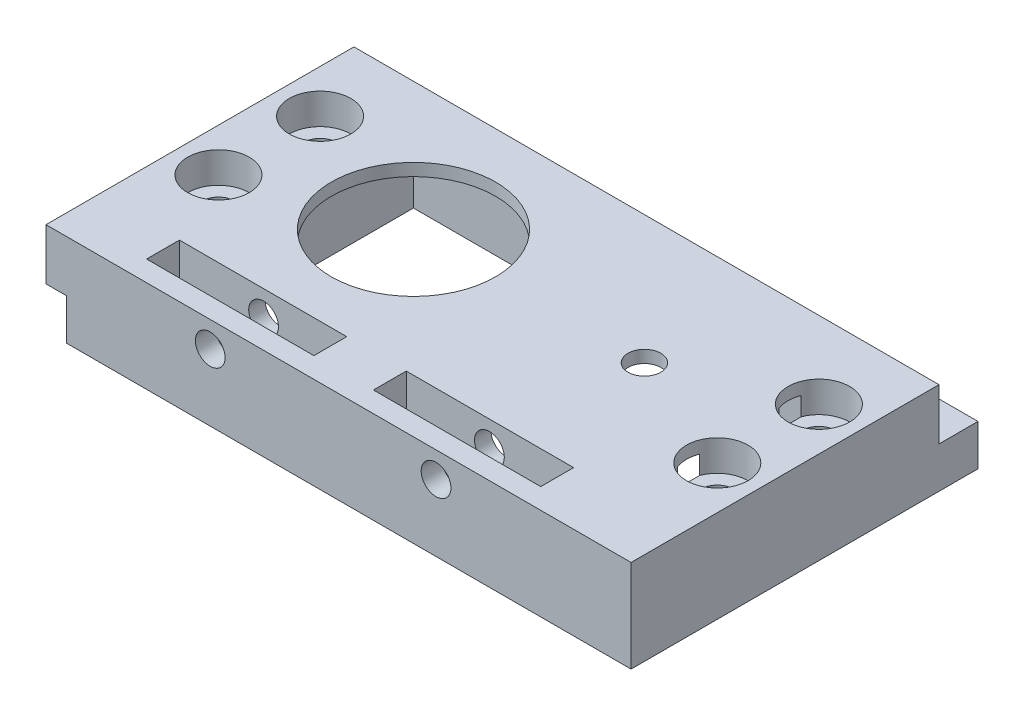
from build123d import *
from build123d.topology import SkipClean

# Parameters (mm, degrees)
SKETCH1_W                = 50
SKETCH1_H                = 25
SKETCH1_R                = 1.3
SKETCH1_R_2              = 4.5
BOSS_EXTRUDE1_DEPTH      = 2.5
SKETCH2_W                = 50
SKETCH2_H                = 12
BOSS_EXTRUDE2_DEPTH      = 3
SKETCH3_W                = 50
SKETCH3_H                = 28
BOSS_EXTRUDE3_DEPTH      = 3
SKETCH4_R                = 1.3
CUT_EXTRUDE1_DEPTH       = 34.018933962
SKETCH5_W                = 53
SKETCH5_H                = 32.5
SKETCH5_R                = 1.6
SKETCH5_W_2              = 42
SKETCH5_H_2              = 21.5
BOSS_EXTRUDE4_DEPTH      = 4
SKETCH7_R                = 8
CUT_EXTRUDE2_DEPTH       = 5
SKETCH8_W                = 24.55
SKETCH8_H                = 21.5
CUT_EXTRUDE3_DEPTH       = 3.8
BOSS_EXTRUDE6_DEPTH      = 22.95
BOSS_EXTRUDE7_DEPTH      = 2
CUT_EXTRUDE4_START       = -1.2
SKETCH11_R               = 1.6
CUT_EXTRUDE4_DEPTH       = 1.2
SKETCH12_W               = 7
SKETCH12_H               = 21
SKETCH12_R               = 1.6
BOSS_EXTRUDE8_DEPTH      = 7.8
CUT_EXTRUDE5_DEPTH       = 55.054972019
CUT_EXTRUDE5_DEPTH_BACK  = 55.054972019
SKETCH13_W               = 0.7
SKETCH13_H               = 5
SKETCH13_H_2             = 4
CUT_EXTRUDE6_DEPTH       = 78.713850117
CUT_EXTRUDE6_DEPTH_BACK  = 78.713850117
SKETCH14_W               = 28
SKETCH14_H               = 10
SKETCH16_R               = 3
CUT_EXTRUDE8_DEPTH       = 3
SKETCH15_R               = 1.6
CUT_EXTRUDE9_DEPTH       = 5
SKETCH17_W               = 16.3
SKETCH17_H               = 5
CUT_EXTRUDE10_DEPTH      = 3.2
SKETCH18_R               = 1.45
CUT_EXTRUDE11_DEPTH      = 5
CUT_EXTRUDE12_DEPTH      = 54.307527611
CUT_EXTRUDE12_DEPTH_BACK = 54.307527611
SKETCH19_R               = 1.6
CUT_EXTRUDE14_DEPTH      = 60.569224437
CUT_EXTRUDE14_DEPTH_BACK = 60.569224437
SKETCH20_W               = 17.95
SKETCH20_H               = 5
BOSS_EXTRUDE11_START     = 2
SKETCH21_W               = 16.3
SKETCH21_H               = 5
SKETCH21_R               = 1.45
BOSS_EXTRUDE11_DEPTH     = 2


with BuildPart() as part:
    # Sketch1 → Boss-Extrude1 (new, symmetric)
    with BuildSketch(Plane(origin=(0, 0, 0), x_dir=(1, 0, 0), z_dir=(0, 1, 0))):
        Rectangle(SKETCH1_W, SKETCH1_H)
        with Locations(Location((-11.25, 0, 0), (0, 0, 270))):
            Circle(SKETCH1_R, mode=Mode.SUBTRACT)
        with Locations(Location((11.25, 0, 0), (0, 0, 270))):
            Circle(SKETCH1_R_2, mode=Mode.SUBTRACT)
    extrude(amount=BOSS_EXTRUDE1_DEPTH, both=True)

    # Sketch2 → Boss-Extrude2 (add)
    with BuildSketch(Plane.XY.offset(12.5)):
        with Locations((0, 3.5)):
            Rectangle(SKETCH2_W, SKETCH2_H)
    extrude(amount=BOSS_EXTRUDE2_DEPTH)

    # Sketch3 → Boss-Extrude3 (add)
    with BuildSketch(Plane(origin=(0, 9.5, 0), x_dir=(1, 0, 0), z_dir=(0, 1, 0))):
        with Locations((0, -1.5)):
            Rectangle(SKETCH3_W, SKETCH3_H)
    extrude(amount=BOSS_EXTRUDE3_DEPTH)

    # Sketch4 → Cut-Extrude1 (cut, through all)
    with BuildSketch(Plane(origin=(0, 12.5, 0), x_dir=(1, 0, 0), z_dir=(0, 1, 0))):
        with Locations(Location((11.25, 0, 0), (0, 0, 270))):
            Circle(SKETCH4_R)
        with Locations(Location((-11.25, 0, 0), (0, 0, 270))):
            Circle(SKETCH4_R)
    extrude(amount=-CUT_EXTRUDE1_DEPTH, mode=Mode.SUBTRACT)

    # Sketch5 → Boss-Extrude4 (add)
    with BuildSketch(Plane.XZ.offset(2.5)):
        with Locations((21.45, -0.05)):
            Rectangle(SKETCH5_W, SKETCH5_H)
        with Locations(Location((45.75, -5, 0), (0, 0, 270))):
            Circle(SKETCH5_R, mode=Mode.SUBTRACT)
        with Locations(Location((45.75, 4.9, 0), (0, 0, 270))):
            Circle(SKETCH5_R, mode=Mode.SUBTRACT)
        with Locations(Location((-2.85, 4.9, 0), (0, 0, 270))):
            Circle(SKETCH5_R, mode=Mode.SUBTRACT)
        with Locations(Location((-2.85, -5, 0), (0, 0, 270))):
            Circle(SKETCH5_R, mode=Mode.SUBTRACT)
        with Locations((21.45, -0.05)):
            Rectangle(SKETCH5_W_2, SKETCH5_H_2, mode=Mode.SUBTRACT)
    extrude(amount=BOSS_EXTRUDE4_DEPTH)

    # Sketch7 → Cut-Extrude2 (cut)
    with BuildSketch(Plane.XZ.offset(2.5)):
        with Locations(Location((11.25, 0, 0), (0, 0, 270))):
            Circle(SKETCH7_R)
    extrude(amount=-CUT_EXTRUDE2_DEPTH, mode=Mode.SUBTRACT)

    # Sketch8 → Cut-Extrude3 (cut)
    with BuildSketch(Plane.XZ.offset(2.5)):
        with Locations((12.725, -0.05)):
            Rectangle(SKETCH8_W, SKETCH8_H)
    extrude(amount=-CUT_EXTRUDE3_DEPTH, mode=Mode.SUBTRACT)

    # Sketch9 → Boss-Extrude6 (add)
    with BuildSketch(Plane(origin=(25, 0, 0), x_dir=(0, 0, -1), z_dir=(1, 0, 0))):
        Polygon((12.5, 2.5), (-16.2, 2.5), (-16.2, -2.5), (-10.7, -2.5), (-10.7, 1.3), (10.8, 1.3), (10.8, -2.5), (12.5, -2.5), align=None)
    extrude(amount=BOSS_EXTRUDE6_DEPTH)

    # Sketch10 → Boss-Extrude7 (add)
    with BuildSketch(Plane(origin=(47.95, 0, 0), x_dir=(0, 0, -1), z_dir=(1, 0, 0))):
        Polygon((16.3, -2.5), (12.5, -2.5), (12.5, 2.5), (-16.2, 2.5), (-16.2, -6.5), (16.3, -6.5), align=None)
    extrude(amount=BOSS_EXTRUDE7_DEPTH)

    # Sketch11 → Cut-Extrude4 (cut)
    with BuildSketch(Plane.XZ.offset(-1.3).offset(CUT_EXTRUDE4_START)):
        with Locations(Location((-2.85, 4.9, 0), (0, 0, 270))):
            Circle(SKETCH11_R)
        with Locations(Location((-2.85, -5, 0), (0, 0, 270))):
            Circle(SKETCH11_R)
        with Locations(Location((45.75, 4.9, 0), (0, 0, 270))):
            Circle(SKETCH11_R)
        with Locations(Location((45.75, -5, 0), (0, 0, 270))):
            Circle(SKETCH11_R)
    extrude(amount=CUT_EXTRUDE4_DEPTH, mode=Mode.SUBTRACT)

    # Sketch12 → Boss-Extrude8 (add)
    with BuildSketch(Plane.XZ.offset(-1.3)):
        with Locations((46.45, 0.2)):
            Rectangle(SKETCH12_W, SKETCH12_H)
        with Locations(Location((45.75, 4.9, 0), (0, 0, 90))):
            Circle(SKETCH12_R, mode=Mode.SUBTRACT)
        with Locations(Location((45.75, -5, 0), (0, 0, 90))):
            Circle(SKETCH12_R, mode=Mode.SUBTRACT)
    extrude(amount=BOSS_EXTRUDE8_DEPTH)

    # Sketch13 → Cut-Extrude5 (cut, two sides: drawn at the far end of the back side and taken through both)
    with BuildSketch(Plane.ZY.offset(-25).offset(-CUT_EXTRUDE5_DEPTH_BACK)):
        with Locations((15.85, 0)):
            Rectangle(SKETCH13_W, SKETCH13_H)
        with Locations((15.85, -4.5)):
            Rectangle(SKETCH13_W, SKETCH13_H_2)
    extrude(amount=CUT_EXTRUDE5_DEPTH + CUT_EXTRUDE5_DEPTH_BACK, mode=Mode.SUBTRACT)

    # Sketch14 → Cut-Extrude6 (cut, two sides: drawn at the far end of the back side and taken through both)
    with BuildSketch(Plane.ZY.offset(25).offset(-CUT_EXTRUDE6_DEPTH_BACK)):
        with Locations((1.5, 7.5)):
            Rectangle(SKETCH14_W, SKETCH14_H)
    extrude(amount=CUT_EXTRUDE6_DEPTH + CUT_EXTRUDE6_DEPTH_BACK, mode=Mode.SUBTRACT)

    # Sketch16 → Cut-Extrude8 (cut)
    with BuildSketch(Plane(origin=(0, 2.5, 0), x_dir=(1, 0, 0), z_dir=(0, 1, 0))):
        with Locations(Location((-2.85, 5, 0), (0, 0, 270))):
            Circle(SKETCH16_R)
        with Locations(Location((-2.85, -4.9, 0), (0, 0, 270))):
            Circle(SKETCH16_R)
        with Locations(Location((45.75, 5, 0), (0, 0, 270))):
            Circle(SKETCH16_R)
        with Locations(Location((45.75, -4.9, 0), (0, 0, 270))):
            Circle(SKETCH16_R)
    extrude(amount=-CUT_EXTRUDE8_DEPTH, mode=Mode.SUBTRACT)

    # Sketch15 → Cut-Extrude9 (cut)
    with SkipClean():  # the faces are left unmerged after this step: merging them gives an invalid solid
        with BuildSketch(Plane(origin=(0, 2.5, 0), x_dir=(1, 0, 0), z_dir=(0, 1, 0))):
            with Locations(Location((-2.85, 5, 0), (0, 0, 270))):
                Circle(SKETCH15_R)
            with Locations(Location((-2.85, -4.9, 0), (0, 0, 270))):
                Circle(SKETCH15_R)
        extrude(amount=-CUT_EXTRUDE9_DEPTH, mode=Mode.SUBTRACT)

    # Sketch17 → Cut-Extrude10 (cut)
    with SkipClean():  # the faces are left unmerged after this step: merging them gives an invalid solid
        with BuildSketch(Plane.XY.offset(15.5)):
            with Locations((8.9, 0)):
                Rectangle(SKETCH17_W, SKETCH17_H)
            with Locations((31, 0)):
                Rectangle(SKETCH17_W, SKETCH17_H)
        extrude(amount=-CUT_EXTRUDE10_DEPTH, mode=Mode.SUBTRACT)

    # Sketch18 → Cut-Extrude11 (cut)
    with SkipClean():  # the faces are left unmerged after this step: merging them gives an invalid solid
        with BuildSketch(Plane.XY.offset(12.3)):
            with Locations((8.95, 0)):
                Circle(SKETCH18_R)
            with Locations((30.95, 0)):
                Circle(SKETCH18_R)
        extrude(amount=-CUT_EXTRUDE11_DEPTH, mode=Mode.SUBTRACT)

    # Sketch19 → Cut-Extrude12 (cut, two sides: drawn at the far end of the back side and taken through both)
    with SkipClean():  # the faces are left unmerged after this step: merging them gives an invalid solid
        with BuildSketch(Plane(origin=(0, 2.5, 0), x_dir=(1, 0, 0), z_dir=(0, 1, 0)).offset(-CUT_EXTRUDE12_DEPTH_BACK)):
            with Locations(Location((33.75, 0, 0), (0, 0, 270))):
                Circle(SKETCH19_R)
        extrude(amount=CUT_EXTRUDE12_DEPTH + CUT_EXTRUDE12_DEPTH_BACK, mode=Mode.SUBTRACT)

    # Sketch20 → Cut-Extrude14 (cut, two sides: drawn at the far end of the back side and taken through both)
    with SkipClean():  # the faces are left unmerged after this step: merging them gives an invalid solid
        with BuildSketch(Plane.XY.offset(15.5).offset(-CUT_EXTRUDE14_DEPTH_BACK)):
            with Locations((-16.025, 0)):
                Rectangle(SKETCH20_W, SKETCH20_H)
        extrude(amount=CUT_EXTRUDE14_DEPTH + CUT_EXTRUDE14_DEPTH_BACK, mode=Mode.SUBTRACT)

    # Sketch21 → Boss-Extrude11 (add)
    # profile 1 of 3: a face of its own
    with SkipClean():  # the faces are left unmerged after this step: merging them gives an invalid solid
        with BuildSketch(Plane.XY.offset(15.5).offset(BOSS_EXTRUDE11_START)):
            with Locations((8.9, 0)):
                Rectangle(SKETCH21_W, SKETCH21_H)
            with Locations((8.95, 0)):
                Circle(SKETCH21_R, mode=Mode.SUBTRACT)
        # profile 2 of 3: a face of its own
        with BuildSketch(Plane.XY.offset(15.5).offset(BOSS_EXTRUDE11_START)):
            Polygon((0.75, -2.5), (0.75, 2.5), (-7.05, 2.5), (-7.05, -2.5), (-5.05, -2.5), (-5.05, -6.5), (49.95, -6.5), (49.95, 2.5), (39.15, 2.5), (39.15, -2.5), (22.85, -2.5), (22.85, 2.5), (17.05, 2.5), (17.05, -2.5), align=None)
        # profile 3 of 3: a face of its own
        with BuildSketch(Plane.XY.offset(15.5).offset(BOSS_EXTRUDE11_START)):
            with Locations((31, 0)):
                Rectangle(SKETCH21_W, SKETCH21_H)
            with Locations((30.95, 0)):
                Circle(SKETCH21_R, mode=Mode.SUBTRACT)
        extrude(amount=-BOSS_EXTRUDE11_DEPTH)


solid = part.part
